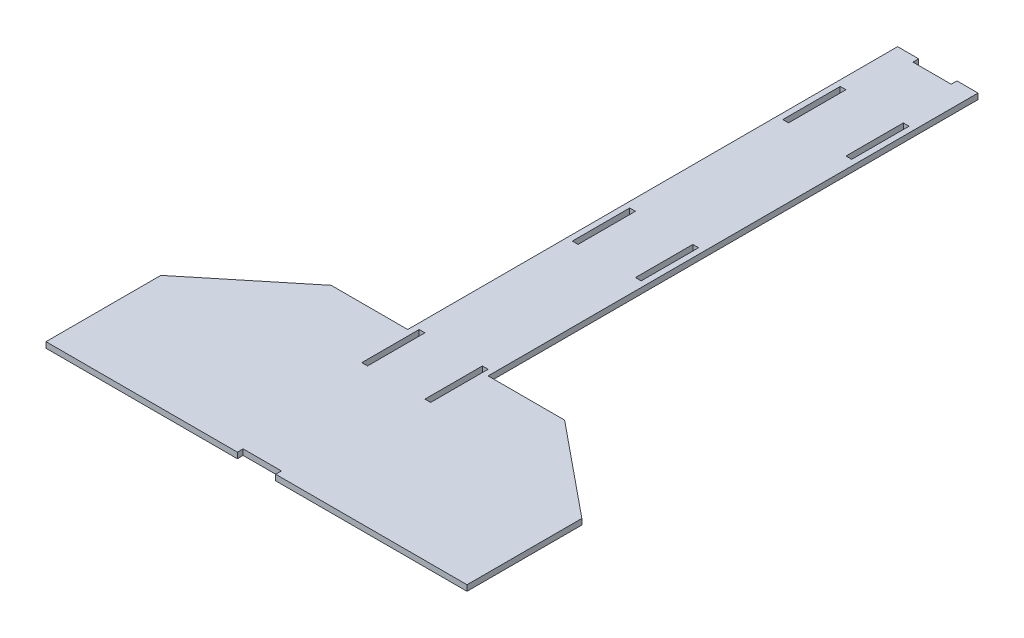
from build123d import *

# Parameters (mm, degrees)
SKETCH1_W           = 3
SKETCH1_H           = 30
BOSS_EXTRUDE1_DEPTH = 3


with BuildPart() as part:
    # Sketch1 → Boss-Extrude1 (new body)
    with BuildSketch(Plane(origin=(0, 0, 0), x_dir=(1, 0, 0), z_dir=(0, 1, 0))):
        Polygon((0, 100), (0, 356), (11, 356), (11, 353), (31, 353), (31, 356), (42, 356), (42, 100), (82, 100), (131, 60), (131, 0), (31, 0), (31, 3), (11, 3), (11, 0), (-89, 0), (-89, 60), (-40, 100), align=None)
        with Locations((37.5, 88)):
            Rectangle(SKETCH1_W, SKETCH1_H, mode=Mode.SUBTRACT)
        with Locations((37.5, 198)):
            Rectangle(SKETCH1_W, SKETCH1_H, mode=Mode.SUBTRACT)
        with Locations((37.5, 308)):
            Rectangle(SKETCH1_W, SKETCH1_H, mode=Mode.SUBTRACT)
        with Locations((4.5, 88)):
            Rectangle(SKETCH1_W, SKETCH1_H, mode=Mode.SUBTRACT)
        with Locations((4.5, 198)):
            Rectangle(SKETCH1_W, SKETCH1_H, mode=Mode.SUBTRACT)
        with Locations((4.5, 308)):
            Rectangle(SKETCH1_W, SKETCH1_H, mode=Mode.SUBTRACT)
    extrude(amount=BOSS_EXTRUDE1_DEPTH)


solid = part.part
